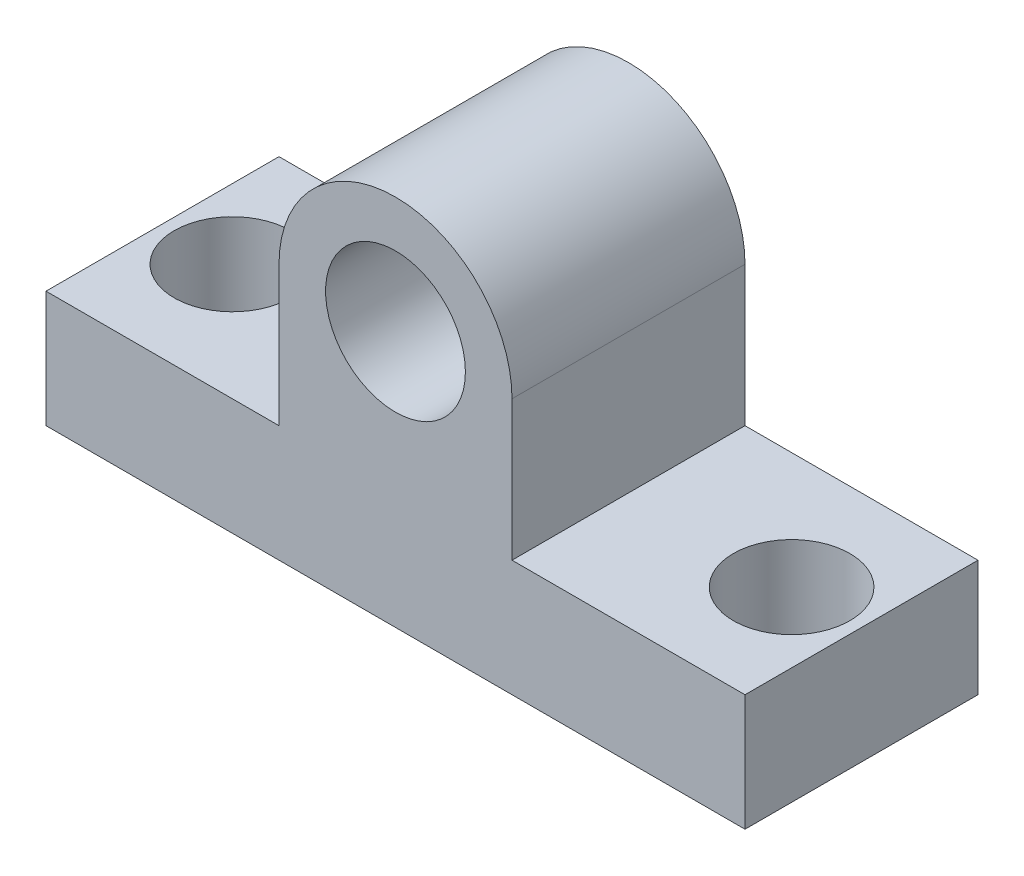
from build123d import *

# Parameters (mm, degrees)
SKETCH_1_R          = 3
EXTRUDE_1_DEPTH     = 10
SKETCH_2_R          = 2.5
CUT_EXTRUDE_1_DEPTH = 5
SKETCH_3_R          = 2.5
CUT_EXTRUDE_2_DEPTH = 5


with BuildPart() as part:
    # 草图1 → 凸台-拉伸1 (new body)
    with BuildSketch(Plane.XY):
        with BuildLine():
            Line((5, 0), (15, 0))
            Line((15, 0), (15, -5))
            Line((15, -5), (-15, -5))
            Line((-15, -5), (-15, 0))
            Line((-15, 0), (-5, 0))
            Line((-5, 0), (-5, 6))
            ThreePointArc((-5, 6), (0, 11), (5, 6))
            Line((5, 6), (5, 0))
        make_face()
        with Locations((0, 6)):
            Circle(SKETCH_1_R, mode=Mode.SUBTRACT)
    extrude(amount=EXTRUDE_1_DEPTH)

    # 草图2 → 切除-拉伸1 (cut)
    with BuildSketch(Plane(origin=(0, 0, 0), x_dir=(1, 0, 0), z_dir=(0, 1, 0))):
        with Locations(Location((-12, -5, 0), (0, 0, 180))):
            Circle(SKETCH_2_R)
    extrude(amount=-CUT_EXTRUDE_1_DEPTH, mode=Mode.SUBTRACT)

    # 草图3 → 切除-拉伸2 (cut)
    with BuildSketch(Plane(origin=(0, 0, 0), x_dir=(1, 0, 0), z_dir=(0, 1, 0))):
        with Locations(Location((12, -5, 0), (0, 0, 180))):
            Circle(SKETCH_3_R)
    extrude(amount=-CUT_EXTRUDE_2_DEPTH, mode=Mode.SUBTRACT)


solid = part.part
